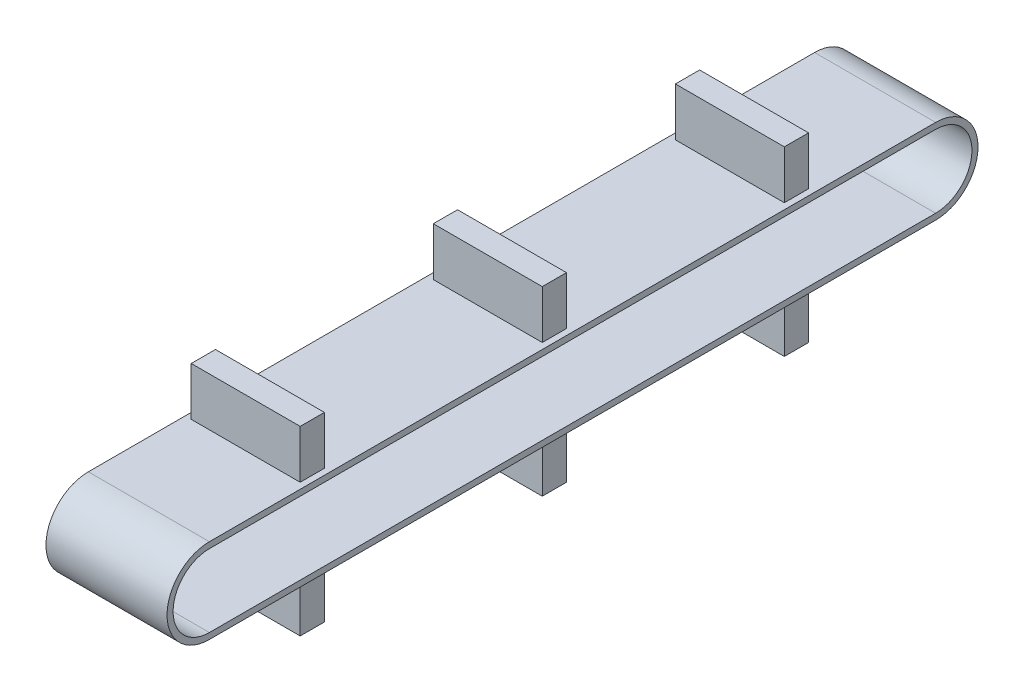
from build123d import *

# Parameters (mm, degrees)
SALIENTE_EXTRUIR1_DEPTH = 50
CROQUIS2_W              = 45
CROQUIS2_H              = 10
SALIENTE_EXTRUIR2_DEPTH = 20
CROQUIS3_W              = 45
CROQUIS3_H              = 10
SALIENTE_EXTRUIR3_DEPTH = 20


with BuildPart() as part:
    # Croquis1 → Saliente-Extruir1 (new body)
    with BuildSketch(Plane(origin=(0, 0, 0), x_dir=(0, 0, -1), z_dir=(1, 0, 0))):
        with BuildLine():
            Line((-54.179530832, 17.5), (245.820469168, 17.5))
            ThreePointArc((245.820469168, 17.5), (263.320469168, 0), (245.820469168, -17.5))
            Line((245.820469168, -17.5), (-54.179530832, -17.5))
            ThreePointArc((-54.179530832, -17.5), (-71.679530832, 0), (-54.179530832, 17.5))
        make_face()
        with BuildLine():
            Line((-54.179530832, 15), (245.820469168, 15))
            ThreePointArc((245.820469168, 15), (260.820469168, 0), (245.820469168, -15))
            Line((245.820469168, -15), (-54.179530832, -15))
            ThreePointArc((-54.179530832, -15), (-69.179530832, 0), (-54.179530832, 15))
        make_face(mode=Mode.SUBTRACT)
    extrude(amount=SALIENTE_EXTRUIR1_DEPTH)

    # Croquis2 → Saliente-Extruir2 (add)
    with BuildSketch(Plane(origin=(0, 17.5, 0), x_dir=(1, 0, 0), z_dir=(0, 1, 0))):
        with Locations((25, 190.820469168)):
            Rectangle(CROQUIS2_W, CROQUIS2_H)
        with Locations((25, 90.820469168)):
            Rectangle(CROQUIS2_W, CROQUIS2_H)
        with Locations((25, -9.179530832)):
            Rectangle(CROQUIS2_W, CROQUIS2_H)
    extrude(amount=SALIENTE_EXTRUIR2_DEPTH)

    # Croquis3 → Saliente-Extruir3 (add)
    with BuildSketch(Plane.XZ.offset(17.5)):
        with Locations((25, -190.820469168)):
            Rectangle(CROQUIS3_W, CROQUIS3_H)
        with Locations((25, -90.820469168)):
            Rectangle(CROQUIS3_W, CROQUIS3_H)
        with Locations((25, 9.179530832)):
            Rectangle(CROQUIS3_W, CROQUIS3_H)
    extrude(amount=SALIENTE_EXTRUIR3_DEPTH)


solid = part.part
